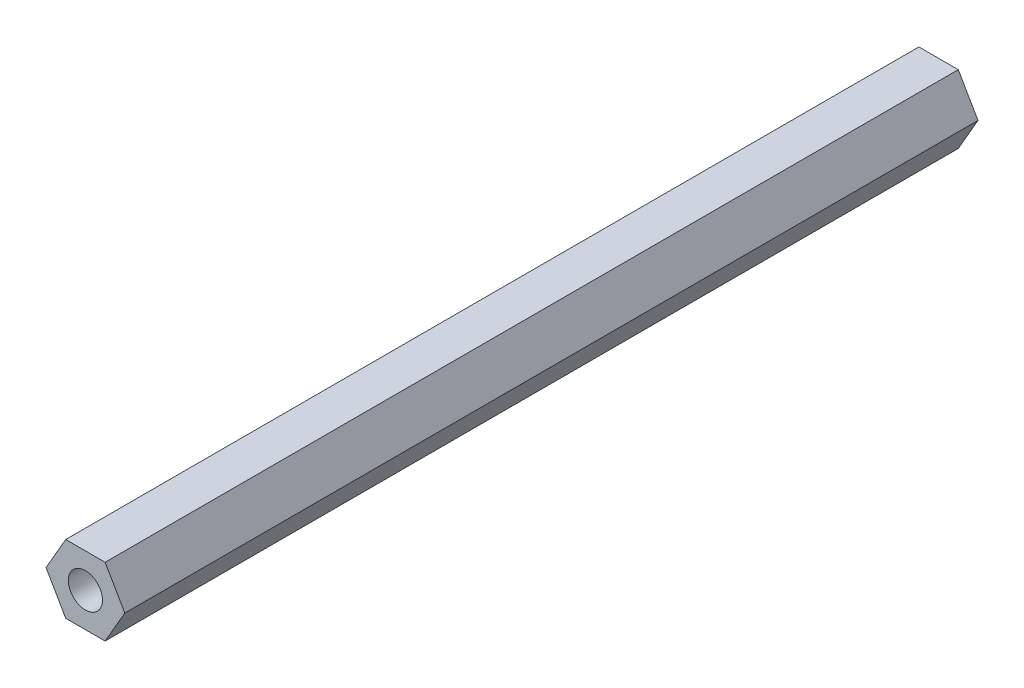
from build123d import *

# Parameters (mm, degrees)
BOSS_EXTRUDE1_DEPTH     = 158.75
CUT_EXTRUDE1_DEPTH      = 160.046057271
CUT_EXTRUDE1_DEPTH_BACK = 160.046057271
SKETCH2_R               = 3.175


with BuildPart() as part:
    # Sketch1 → Boss-Extrude1 (new body)
    with BuildSketch(Plane.XY):
        Polygon((7.332348419, 0), (3.666174209, 6.35), (-3.666174209, 6.35), (-7.332348419, 0), (-3.666174209, -6.35), (3.666174209, -6.35), align=None)
    extrude(amount=BOSS_EXTRUDE1_DEPTH)

    # Sketch2 → Cut-Extrude1 (cut, two sides: drawn at the far end of the back side and taken through both)
    with BuildSketch(Plane.XY.offset(158.75).offset(-CUT_EXTRUDE1_DEPTH_BACK)):
        Circle(SKETCH2_R)
    extrude(amount=CUT_EXTRUDE1_DEPTH + CUT_EXTRUDE1_DEPTH_BACK, mode=Mode.SUBTRACT)


solid = part.part
